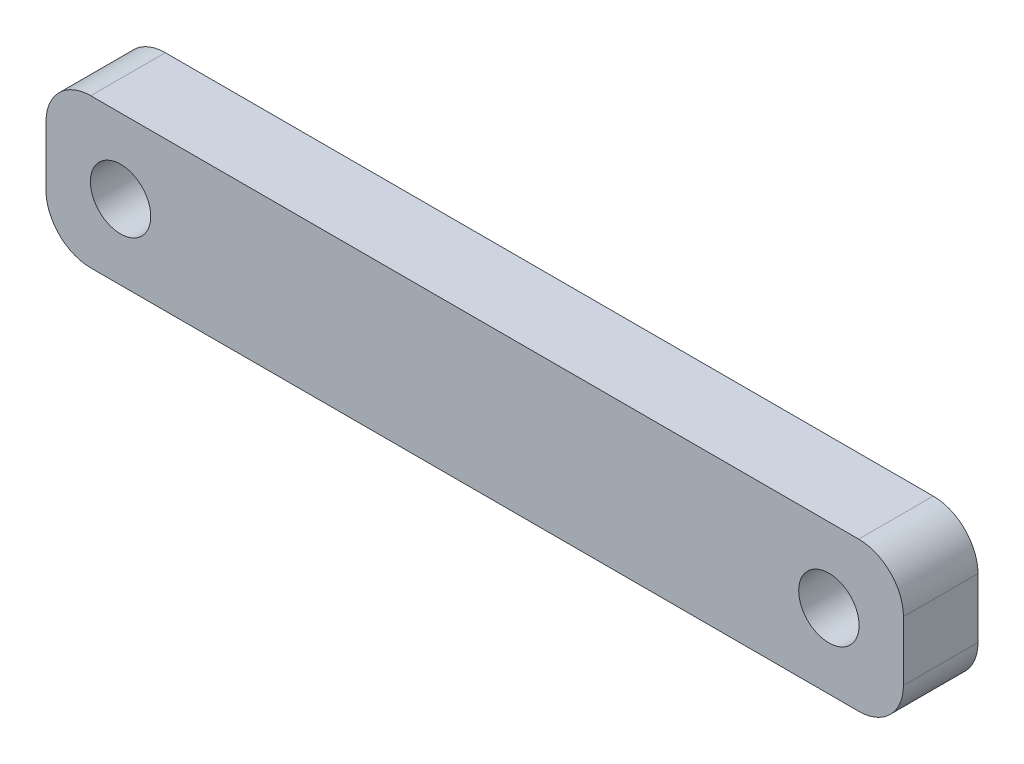
from build123d import *

# Parameters (mm, degrees)
SKETCH_5_W          = 57.5
SKETCH_5_H          = 5
EXTRUDE_3_DEPTH     = 10
SKETCH_6_R          = 2.025
CUT_EXTRUDE_4_DEPTH = 59.576872569
FILLET_4_R          = 3


with BuildPart() as part:
    # 草图5 → 凸台-拉伸3 (new body)
    with BuildSketch(Plane(origin=(0, 0, 0), x_dir=(1, 0, 0), z_dir=(0, 1, 0))):
        with Locations((28.75, 2.5)):
            Rectangle(SKETCH_5_W, SKETCH_5_H)
    extrude(amount=EXTRUDE_3_DEPTH)

    # 草图6 → 切除-拉伸4 (cut, through all)
    with BuildSketch(Plane(origin=(0, 0, -5), x_dir=(-1, 0, 0), z_dir=(0, 0, -1))):
        with Locations((-52.5, 5)):
            Circle(SKETCH_6_R)
        with Locations((-5, 5)):
            Circle(SKETCH_6_R)
    extrude(amount=-CUT_EXTRUDE_4_DEPTH, mode=Mode.SUBTRACT)

    # 圆角4
    fillet_4_edges = [part.edges().sort_by_distance(p)[0] for p in [
        (57.5, 10, -2.5),
        (0, 10, -2.5),
        (57.5, 0, -2.5),
        (0, 0, -2.5),
    ]]
    fillet(fillet_4_edges, radius=FILLET_4_R)


solid = part.part
